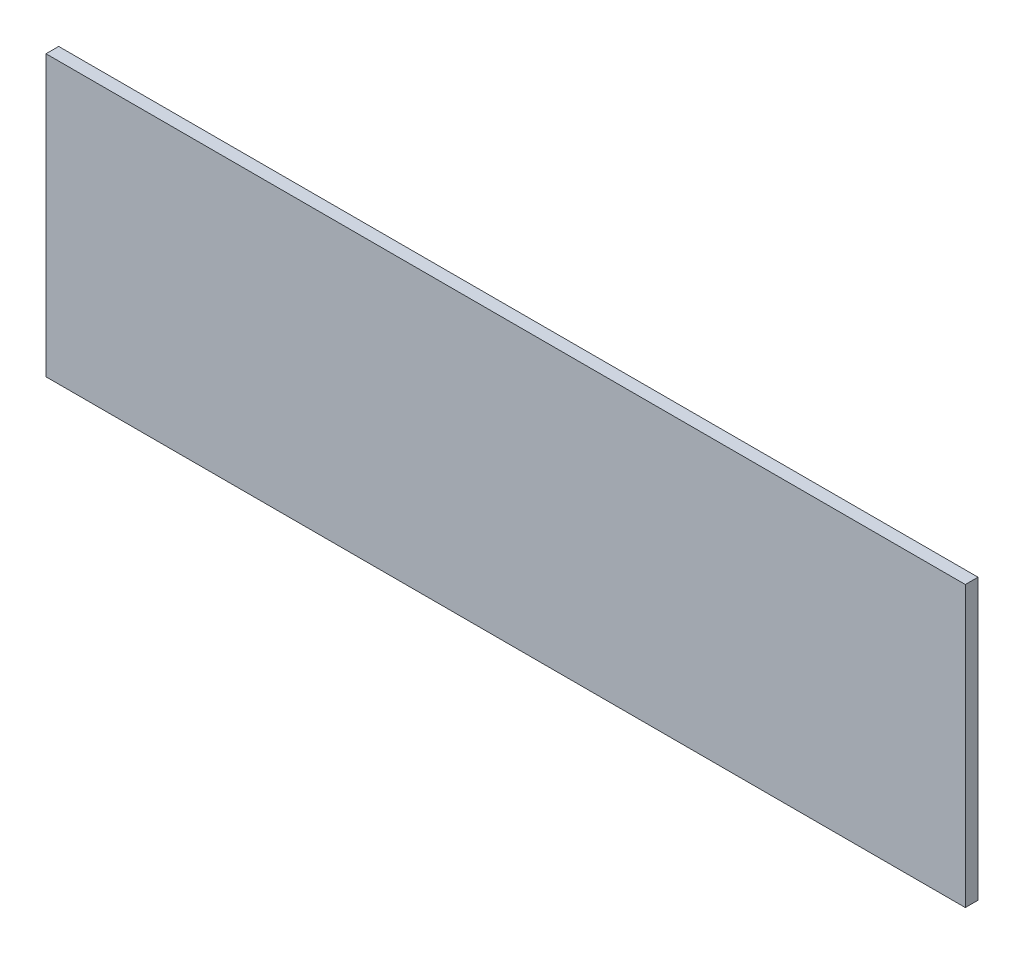
from build123d import *

# Parameters (mm, degrees)
SKETCH1_W           = 460
SKETCH1_H           = 140
BOSS_EXTRUDE1_DEPTH = 6.35


with BuildPart() as part:
    # Sketch1 → Boss-Extrude1 (new body)
    with BuildSketch(Plane.XY):
        Rectangle(SKETCH1_W, SKETCH1_H)
    extrude(amount=BOSS_EXTRUDE1_DEPTH)


solid = part.part
